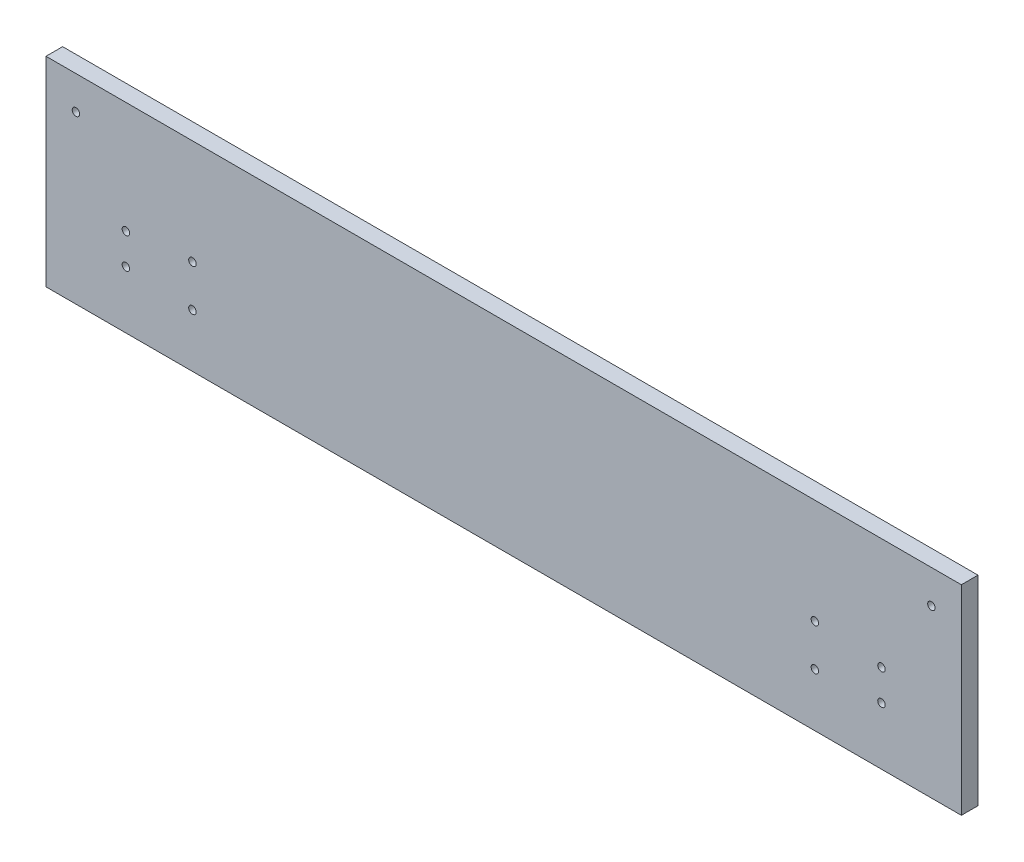
from build123d import *

# Parameters (mm, degrees)
SCHIZZO1_W                   = 550
SCHIZZO1_H                   = 120
ESTRUSIONE_ESTRUSIONE1_DEPTH = 10
SCHIZZO2_R                   = 2.25
TAGLIO_ESTRUSIONE1_DEPTH     = 10
SCHIZZO3_R                   = 2.25
TAGLIO_ESTRUSIONE2_DEPTH     = 10


with BuildPart() as part:
    # Schizzo1 → Estrusione-Estrusione1 (new body)
    with BuildSketch(Plane.XY):
        Rectangle(SCHIZZO1_W, SCHIZZO1_H)
    extrude(amount=ESTRUSIONE_ESTRUSIONE1_DEPTH)

    # Schizzo2 → Taglio-Estrusione1 (cut)
    with BuildSketch(Plane.XY.offset(10)):
        with Locations((-227, -7)):
            Circle(SCHIZZO2_R)
        with Locations((-227, -25.5)):
            Circle(SCHIZZO2_R)
        with Locations((227, -7)):
            Circle(SCHIZZO2_R)
        with Locations((227, -25.5)):
            Circle(SCHIZZO2_R)
        with Locations((-257, 40)):
            Circle(SCHIZZO2_R)
        with Locations((257, 40)):
            Circle(SCHIZZO2_R)
    extrude(amount=-TAGLIO_ESTRUSIONE1_DEPTH, mode=Mode.SUBTRACT)

    # Schizzo3 → Taglio-Estrusione2 (cut)
    with BuildSketch(Plane(origin=(0, 0, 0), x_dir=(-1, 0, 0), z_dir=(0, 0, -1))):
        with Locations((187, -28)):
            Circle(SCHIZZO3_R)
        with Locations((187, -3)):
            Circle(SCHIZZO3_R)
        with Locations((-187, -3)):
            Circle(SCHIZZO3_R)
        with Locations((-187, -28)):
            Circle(SCHIZZO3_R)
    extrude(amount=-TAGLIO_ESTRUSIONE2_DEPTH, mode=Mode.SUBTRACT)


solid = part.part
